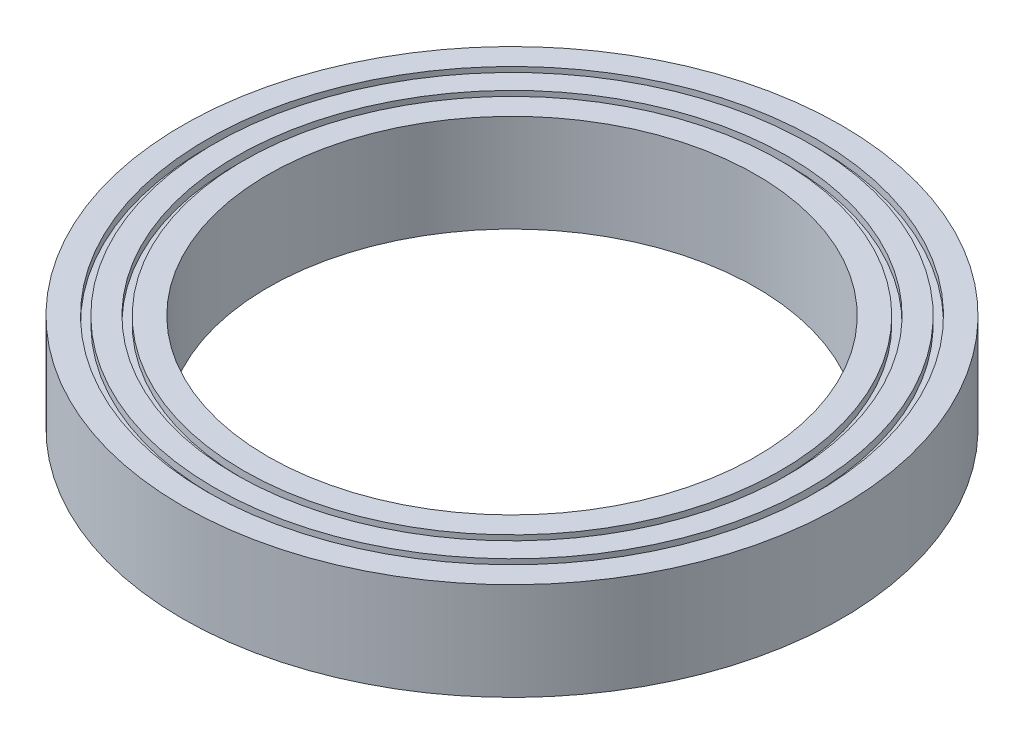
from build123d import *

# Parameters (mm, degrees)
SKETCH_1_R          = 13.5
SKETCH_1_R_2        = 10
EXTRUDE_1_DEPTH     = 4
SKETCH_2_R          = 12.5
SKETCH_2_R_2        = 12.2
SKETCH_2_R_3        = 11.3
SKETCH_2_R_4        = 11
CUT_EXTRUDE_1_DEPTH = 0.3


with BuildPart() as part:
    # 草图1 → 凸台-拉伸1 (new body)
    with BuildSketch(Plane(origin=(0, 0, 0), x_dir=(1, 0, 0), z_dir=(0, 1, 0))):
        with Locations(Location((0, 0, 0), (0, 0, 270))):
            Circle(SKETCH_1_R)
        with Locations(Location((0, 0, 0), (0, 0, 270))):
            Circle(SKETCH_1_R_2, mode=Mode.SUBTRACT)
    extrude(amount=EXTRUDE_1_DEPTH)

    # 草图2 → 切除-拉伸1 (cut)
    # profile 1 of 2: a face of its own
    with BuildSketch(Plane(origin=(0, 4, 0), x_dir=(1, 0, 0), z_dir=(0, 1, 0))):
        with Locations(Location((0, 0, 0), (0, 0, 270))):
            Circle(SKETCH_2_R)
        with Locations(Location((0, 0, 0), (0, 0, 270))):
            Circle(SKETCH_2_R_2, mode=Mode.SUBTRACT)
    # profile 2 of 2: a face of its own
    with BuildSketch(Plane(origin=(0, 4, 0), x_dir=(1, 0, 0), z_dir=(0, 1, 0))):
        with Locations(Location((0, 0, 0), (0, 0, 270))):
            Circle(SKETCH_2_R_3)
        with Locations(Location((0, 0, 0), (0, 0, 270))):
            Circle(SKETCH_2_R_4, mode=Mode.SUBTRACT)
    cut_extrude_1 = extrude(amount=-CUT_EXTRUDE_1_DEPTH, mode=Mode.SUBTRACT)

    # 镜向1: 切除-拉伸1 across plane
    add(cut_extrude_1.mirror(Plane.ZX.offset(2)), mode=Mode.SUBTRACT)


solid = part.part
